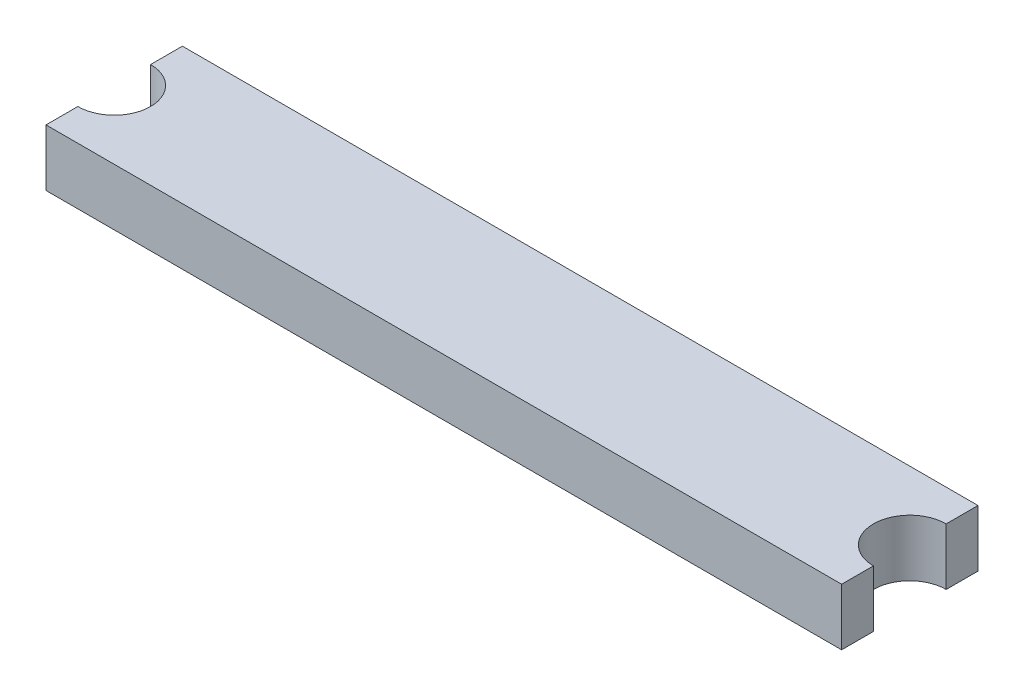
from build123d import *

# Parameters (mm, degrees)
SKETCH1_W           = 350
SKETCH1_H           = 60
BOSS_EXTRUDE1_DEPTH = 25
SKETCH2_R           = 16
CUT_EXTRUDE1_DEPTH  = 180.30421077


with BuildPart() as part:
    # Sketch1 → Boss-Extrude1 (new body)
    with BuildSketch(Plane(origin=(0, 0, 0), x_dir=(1, 0, 0), z_dir=(0, 1, 0))):
        Rectangle(SKETCH1_W, SKETCH1_H)
    extrude(amount=BOSS_EXTRUDE1_DEPTH)

    # Sketch2 → Cut-Extrude1 (cut, through all)
    with BuildSketch(Plane(origin=(0, 25, 0), x_dir=(1, 0, 0), z_dir=(0, 1, 0))):
        with Locations((-175, 0)):
            Circle(SKETCH2_R)
        with Locations((175, 0)):
            Circle(SKETCH2_R)
    extrude(amount=-CUT_EXTRUDE1_DEPTH, mode=Mode.SUBTRACT)


solid = part.part
